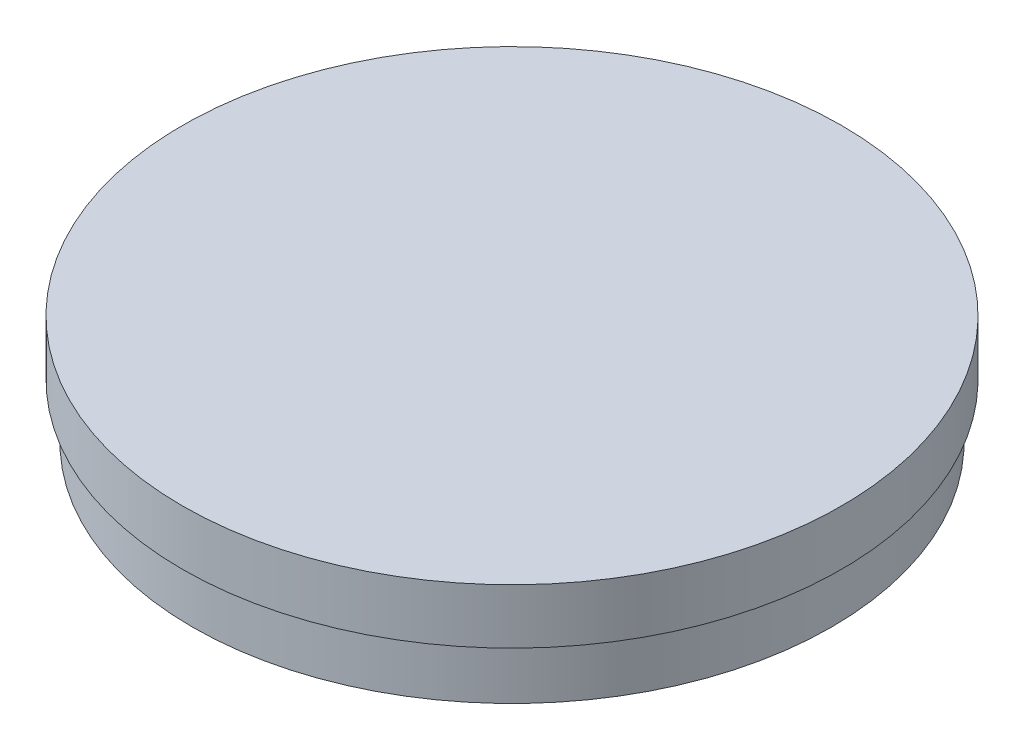
from build123d import *

# Parameters (mm, degrees)
SKETCH1_R           = 76.2
BOSS_EXTRUDE1_DEPTH = 12.7
SKETCH2_R           = 73.914
BOSS_EXTRUDE2_DEPTH = 12.7


with BuildPart() as part:
    # Sketch1 → Boss-Extrude1 (new body)
    with BuildSketch(Plane(origin=(0, 0, 0), x_dir=(1, 0, 0), z_dir=(0, 1, 0))):
        with Locations(Location((0, 0, 0), (0, 0, 270))):
            Circle(SKETCH1_R)
    extrude(amount=BOSS_EXTRUDE1_DEPTH)

    # Sketch2 → Boss-Extrude2 (add)
    with BuildSketch(Plane.XZ):
        with Locations(Location((0, 0, 0), (0, 0, 270))):
            Circle(SKETCH2_R)
    extrude(amount=BOSS_EXTRUDE2_DEPTH)


solid = part.part
